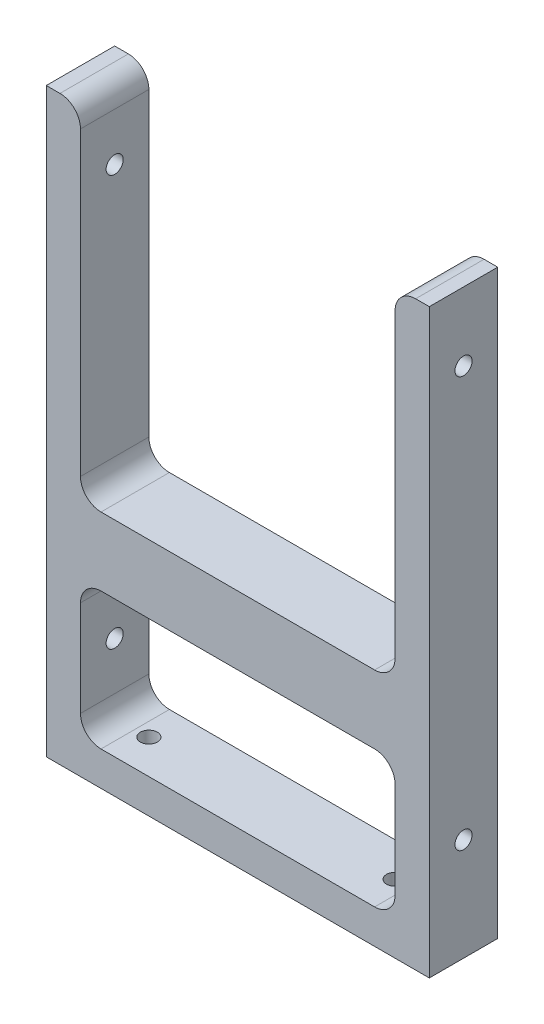
from build123d import *

# Parameters (mm, degrees)
SKETCH_1_W      = 46
SKETCH_1_H      = 20
EXTRUDE_1_DEPTH = 10
FILLET_1_R      = 3
M3X0_51_D       = 2.5
M3X0_51_DEPTH   = 5
M3X0_52_D       = 2.5


with BuildPart() as part:
    # Эскиз1 → Бобышка-Вытянуть1 (new body)
    with BuildSketch(Plane.XY):
        Polygon((-28, 42.5), (-23, 42.5), (-23, -7.5), (23, -7.5), (23, 42.5), (28, 42.5), (28, -42.5), (-28, -42.5), align=None)
        with Locations((0, -27.5)):
            Rectangle(SKETCH_1_W, SKETCH_1_H, mode=Mode.SUBTRACT)
    extrude(amount=EXTRUDE_1_DEPTH)

    # Скругление1
    fillet_1_edges = [part.edges().sort_by_distance(p)[0] for p in [
        (-23, 42.5, 5),
        (-23, -7.5, 5),
        (23, -7.5, 5),
        (23, 42.5, 5),
        (23, -37.5, 5),
        (23, -17.5, 5),
        (-23, -17.5, 5),
        (-23, -37.5, 5),
    ]]
    fillet(fillet_1_edges, radius=FILLET_1_R)

    # Отверстие обработанное метчиком M3x0.51
    with Locations(Plane(origin=(0, -42.5, 0), x_dir=(-1, 0, 0), z_dir=(0, -1, 0))):
        with Locations((18, -5), (-18, -5)):
            Hole(M3X0_51_D / 2, depth=M3X0_51_DEPTH)

    # Отверстие обработанное метчиком M3x0.52 (through all)
    with Locations(Plane(origin=(28, 0, 0), x_dir=(0, 0, -1), z_dir=(1, 0, 0))):
        with Locations((-5, 32.5), (-5, -27.5)):
            Hole(M3X0_52_D / 2)


solid = part.part
